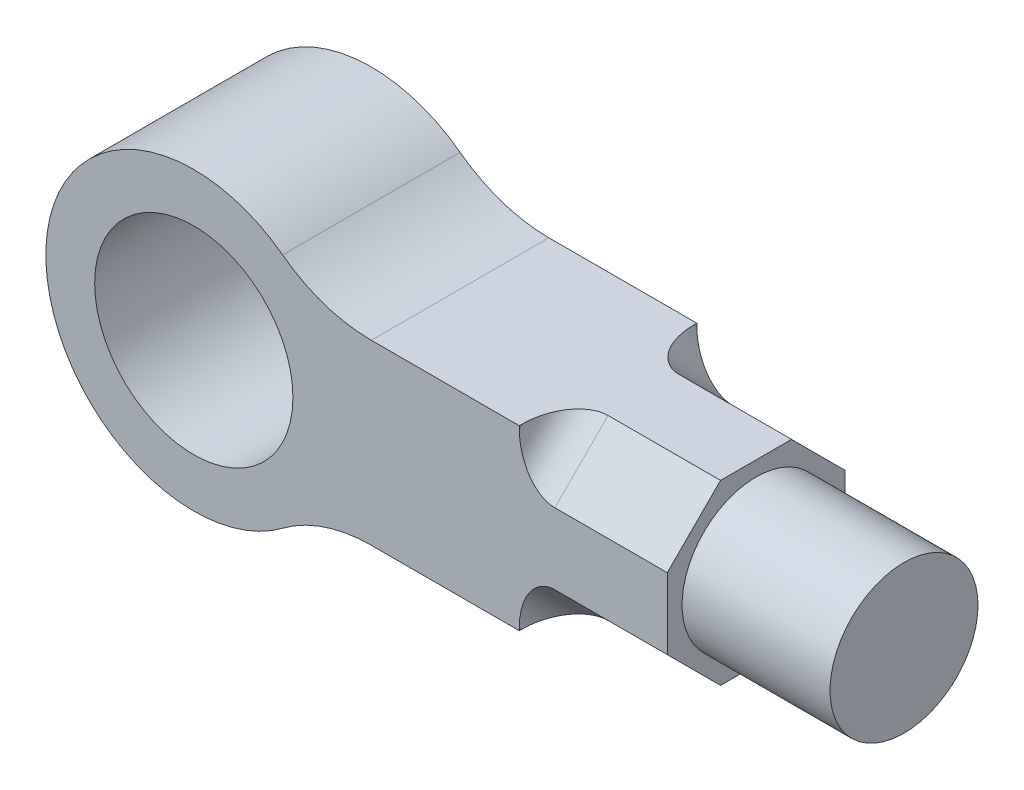
from build123d import *

# Parameters (mm, degrees)
SKETCH2_R           = 33.5
BOSS_EXTRUDE1_DEPTH = 60
CUT_EXTRUDE1_DEPTH  = 50
SKETCH3_3_R         = 25
BOSS_EXTRUDE2_DEPTH = 50
FILLET1_R           = 12


with BuildPart() as part:
    # Sketch2 → Boss-Extrude1 (new body)
    with BuildSketch(Plane.XY):
        with BuildLine():
            Line((60, 30), (160, 30))
            Line((160, 30), (160, -30))
            Line((160, -30), (60, -30))
            ThreePointArc((60, -30), (44.188611699, -32.565835097), (30, -40))
            ThreePointArc((30, -40), (-50, 0), (30, 40))
            ThreePointArc((30, 40), (44.188611699, 32.565835097), (60, 30))
        make_face()
        Circle(SKETCH2_R, mode=Mode.SUBTRACT)
    extrude(amount=BOSS_EXTRUDE1_DEPTH)

    # Sketch3 → Cut-Extrude1 (cut)
    with BuildSketch(Plane(origin=(160, 0, 0), x_dir=(0, 0, -1), z_dir=(1, 0, 0))):
        Polygon((0, 30), (-18, 30), (0, 12), align=None)
        Polygon((-60, 12), (-42, 30), (-60, 30), align=None)
        Polygon((0, -30), (0, -12), (-18, -30), align=None)
        Polygon((-42, -30), (-60, -12), (-60, -30), align=None)
    extrude(amount=-CUT_EXTRUDE1_DEPTH, mode=Mode.SUBTRACT)

    # Sketch3<3> → Boss-Extrude2 (add)
    with BuildSketch(Plane(origin=(160, 0, 0), x_dir=(0, 0, -1), z_dir=(1, 0, 0))):
        with Locations((-30, 0)):
            Circle(SKETCH3_3_R)
    extrude(amount=BOSS_EXTRUDE2_DEPTH)

    # Fillet1
    fillet1_edges = [part.edges().sort_by_distance(p)[0] for p in [
        (110, -21, 9),
        (110, -21, 51),
        (110, 21, 9),
        (110, 21, 51),
    ]]
    fillet(fillet1_edges, radius=FILLET1_R)


solid = part.part
